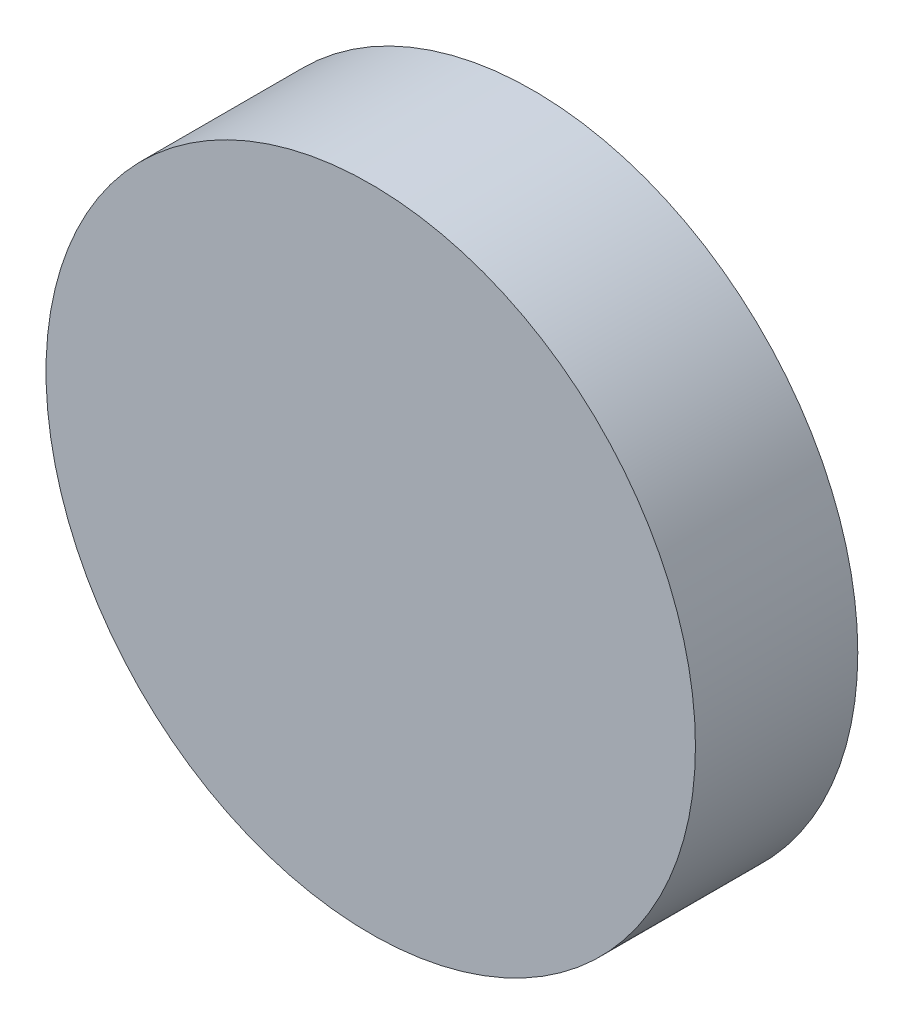
from build123d import *

# Parameters (mm, degrees)
SKETCH2_R           = 2
BOSS_EXTRUDE1_DEPTH = 1


with BuildPart() as part:
    # Sketch2 → Boss-Extrude1 (new body)
    with BuildSketch(Plane.XY):
        Circle(SKETCH2_R)
    extrude(amount=BOSS_EXTRUDE1_DEPTH)


solid = part.part
